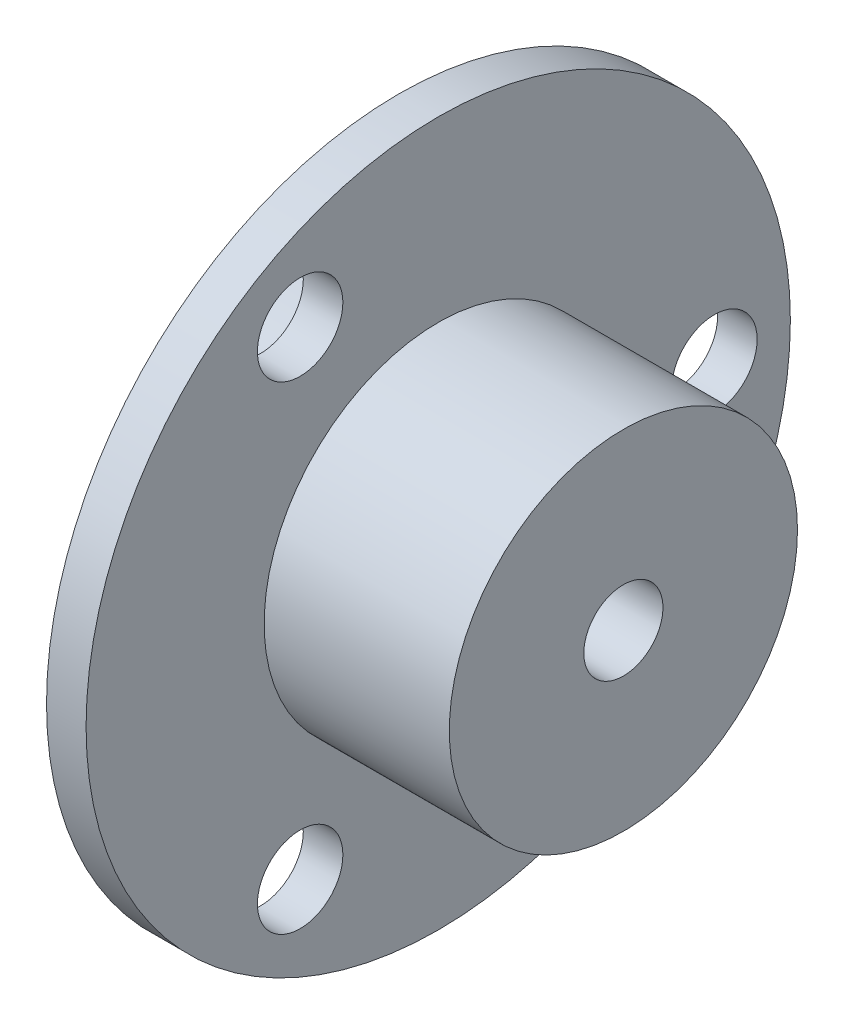
from build123d import *

# Parameters (mm, degrees)
SKETCH1_R           = 22.25
BOSS_EXTRUDE1_DEPTH = 2.5
SKETCH2_R           = 2.7
CUT_EXTRUDE1_DEPTH  = 32.565408282
BOSS_EXTRUDE2_START = -7.3
SKETCH3_R           = 11
BOSS_EXTRUDE2_DEPTH = 19
SKETCH4_R           = 2.5
CUT_EXTRUDE2_DEPTH  = 37.757652265


with BuildPart() as part:
    # Sketch1 → Boss-Extrude1 (new body)
    with BuildSketch(Plane(origin=(0, 0, 0), x_dir=(0, 0, -1), z_dir=(1, 0, 0))):
        Circle(SKETCH1_R)
    extrude(amount=BOSS_EXTRUDE1_DEPTH)

    # Sketch2 → Cut-Extrude1 (cut, through all)
    with BuildSketch(Plane(origin=(2.5, 0, 0), x_dir=(0, 0, -1), z_dir=(1, 0, 0))):
        with Locations((17.45, 0)):
            Circle(SKETCH2_R)
        with Locations((-8.725, 15.112143296)):
            Circle(SKETCH2_R)
        with Locations((-8.725, -15.112143296)):
            Circle(SKETCH2_R)
    extrude(amount=-CUT_EXTRUDE1_DEPTH, mode=Mode.SUBTRACT)

    # Sketch3 → Boss-Extrude2 (add)
    with BuildSketch(Plane(origin=(2.5, 0, 0), x_dir=(0, 0, -1), z_dir=(1, 0, 0)).offset(BOSS_EXTRUDE2_START)):
        Circle(SKETCH3_R)
    extrude(amount=BOSS_EXTRUDE2_DEPTH)

    # Sketch4 → Cut-Extrude2 (cut, through all)
    with BuildSketch(Plane.ZY.offset(4.8)):
        Circle(SKETCH4_R)
    extrude(amount=-CUT_EXTRUDE2_DEPTH, mode=Mode.SUBTRACT)


solid = part.part
